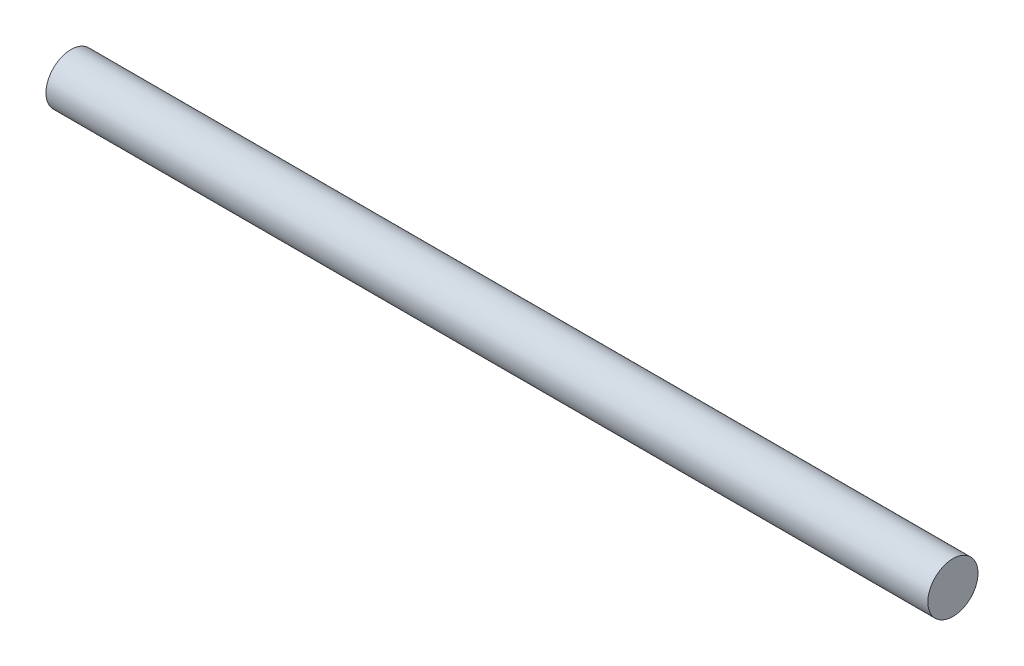
from build123d import *

# Parameters (mm, degrees)
CROQUIS1_R              = 2.5
SALIENTE_EXTRUIR1_DEPTH = 87.9


with BuildPart() as part:
    # Croquis1 → Saliente-Extruir1 (new body)
    with BuildSketch(Plane(origin=(0, 0, 0), x_dir=(0, 0, -1), z_dir=(1, 0, 0))):
        Circle(CROQUIS1_R)
    extrude(amount=SALIENTE_EXTRUIR1_DEPTH)


solid = part.part
